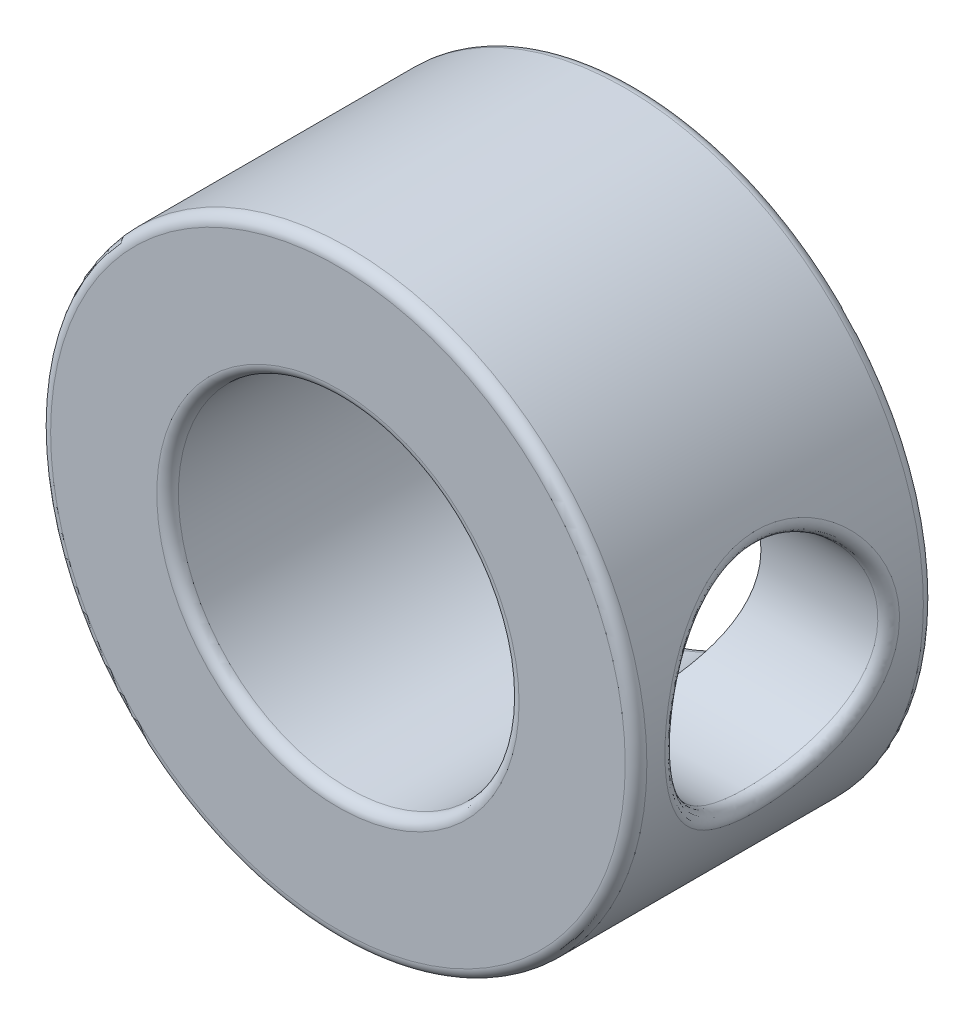
from build123d import *

# Parameters (mm, degrees)
SKETCH2_R           = 7
BOSS_EXTRUDE1_DEPTH = 7
SKETCH3_R           = 4
CUT_EXTRUDE1_DEPTH  = 13.124355653
SKETCH4_R           = 2.499999953
CUT_EXTRUDE2_DEPTH  = 13.124355653
FILLET1_R           = 0.254


with BuildPart() as part:
    # Sketch2 → Boss-Extrude1 (new body)
    with BuildSketch(Plane.XY):
        Circle(SKETCH2_R)
    extrude(amount=BOSS_EXTRUDE1_DEPTH)

    # Sketch3 → Cut-Extrude1 (cut, through all)
    with BuildSketch(Plane.XY.offset(7)):
        Circle(SKETCH3_R)
    extrude(amount=-CUT_EXTRUDE1_DEPTH, mode=Mode.SUBTRACT)

    # Sketch4 → Cut-Extrude2 (cut, through all)
    with BuildSketch(Plane(origin=(0, 0, 0), x_dir=(0, 0, -1), z_dir=(1, 0, 0))):
        with Locations(Location((-3.5687, 0, 0), (0, 0, 180))):
            Circle(SKETCH4_R)
    extrude(amount=CUT_EXTRUDE2_DEPTH, mode=Mode.SUBTRACT)

    # Fillet1
    fillet1_edges = [part.edges().sort_by_distance(p)[0] for p in [
        (6.538348433, 2.499999953, 3.5687),
        (-7, 0, 0),
        (-7, 0, 7),
        (-4, 0, 0),
        (-4, 0, 7),
    ]]
    fillet(fillet1_edges, radius=FILLET1_R)


solid = part.part
